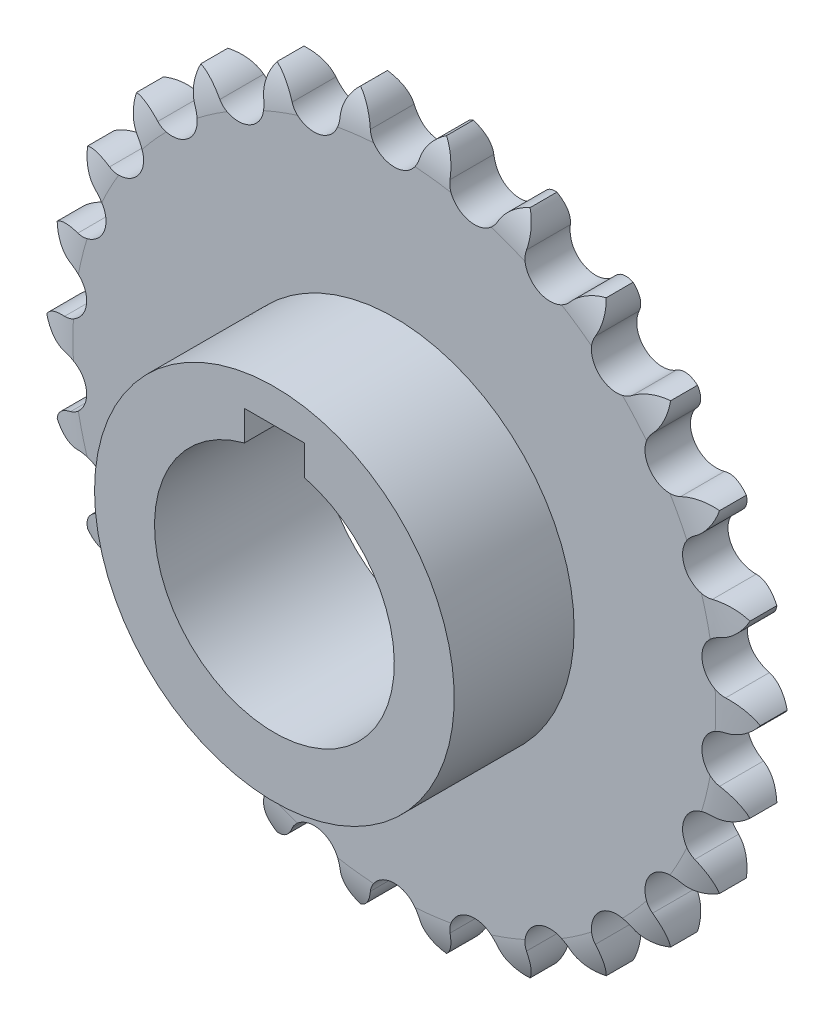
from build123d import *

# Parameters (mm, degrees)
SKETCH2_R           = 12.5
BOSS_EXTRUDE1_DEPTH = 4.7333
SKETCH3_W           = 12.5
SKETCH3_H           = 6.25
SKETCH4_W           = 6.25
SKETCH4_H           = 3.125
CUT_EXTRUDE1_DEPTH  = 56.167615304


with BuildPart() as part:
    # Sketch2 → Boss-Extrude1 (new body)
    with BuildSketch(Plane.XY):
        with BuildLine():
            ThreePointArc((2.578555732, 34.392596644), (0, 32.32485), (-2.578555732, 34.392596644))
            ThreePointArc((-2.578555732, 34.392596644), (-3.257015254, 35.863208352), (-4.483070983, 36.921411294))
            ThreePointArc((-4.483070983, 36.921411294), (-5.42025522, 35.600543465), (-5.727059524, 34.01029907))
            ThreePointArc((-5.727059524, 34.01029907), (-7.735842951, 31.385548607), (-10.734314701, 32.776121514))
            ThreePointArc((-10.734314701, 32.776121514), (-11.74499984, 34.041633927), (-13.188673158, 34.775673074))
            ThreePointArc((-13.188673158, 34.775673074), (-13.782520162, 33.268904395), (-13.699838897, 31.651446536))
            ThreePointArc((-13.699838897, 31.651446536), (-15.022106828, 28.622233211), (-18.266234317, 29.254817338))
            ThreePointArc((-18.266234317, 29.254817338), (-19.550407727, 30.241683474), (-21.127797588, 30.608899139))
            ThreePointArc((-21.127797588, 30.608899139), (-21.343795131, 29.003797528), (-20.876433431, 27.453126977))
            ThreePointArc((-20.876433431, 27.453126977), (-21.435340459, 24.195497658), (-24.73658679, 24.033329515))
            ThreePointArc((-24.73658679, 24.033329515), (-26.21961698, 24.684196302), (-27.839051219, 24.663247244))
            ThreePointArc((-27.839051219, 24.663247244), (-27.664646307, 23.053095374), (-26.839765536, 21.659331467))
            ThreePointArc((-26.839765536, 21.659331467), (-26.602830017, 18.362607728), (-29.769338753, 17.415111938))
            ThreePointArc((-29.769338753, 17.415111938), (-31.365037398, 17.692153364), (-32.932400384, 17.284257068))
            ThreePointArc((-32.932400384, 17.284257068), (-32.377728797, 15.762631112), (-31.243268027, 14.60677434))
            ThreePointArc((-31.243268027, 14.60677434), (-30.224259792, 11.462549783), (-33.072004955, 9.784791356))
            ThreePointArc((-33.072004955, 9.784791356), (-34.68763585, 9.671906781), (-36.111838143, 8.900768696))
            ThreePointArc((-36.111838143, 8.900768696), (-35.209135378, 7.556100024), (-33.831025344, 6.705324582))
            ThreePointArc((-33.831025344, 6.705324582), (-32.089165449, 3.896330109), (-34.45264644, 1.585814268))
            ThreePointArc((-34.45264644, 1.585814268), (-35.994314991, 1.089564132), (-37.19258713, 0))
            ThreePointArc((-37.19258713, 0), (-35.994314991, -1.089564132), (-34.45264644, -1.585814268))
            ThreePointArc((-34.45264644, -1.585814268), (-32.089165449, -3.896330109), (-33.831025344, -6.705324582))
            ThreePointArc((-33.831025344, -6.705324582), (-35.209135378, -7.556100024), (-36.111838143, -8.900768696))
            ThreePointArc((-36.111838143, -8.900768696), (-34.68763585, -9.671906781), (-33.072004955, -9.784791356))
            ThreePointArc((-33.072004955, -9.784791356), (-30.224259792, -11.462549783), (-31.243268027, -14.60677434))
            ThreePointArc((-31.243268027, -14.60677434), (-32.377728797, -15.762631112), (-32.932400384, -17.284257068))
            ThreePointArc((-32.932400384, -17.284257068), (-31.365037398, -17.692153364), (-29.769338753, -17.415111938))
            ThreePointArc((-29.769338753, -17.415111938), (-26.602830017, -18.362607728), (-26.839765536, -21.659331467))
            ThreePointArc((-26.839765536, -21.659331467), (-27.664646307, -23.053095374), (-27.839051219, -24.663247244))
            ThreePointArc((-27.839051219, -24.663247244), (-26.21961698, -24.684196302), (-24.73658679, -24.033329515))
            ThreePointArc((-24.73658679, -24.033329515), (-21.435340459, -24.195497658), (-20.876433431, -27.453126977))
            ThreePointArc((-20.876433431, -27.453126977), (-21.34379513, -29.003797528), (-21.127797588, -30.608899139))
            ThreePointArc((-21.127797588, -30.608899139), (-19.550407727, -30.241683474), (-18.266234317, -29.254817338))
            ThreePointArc((-18.266234317, -29.254817338), (-15.022106828, -28.622233211), (-13.699838897, -31.651446536))
            ThreePointArc((-13.699838897, -31.651446536), (-13.782520162, -33.268904395), (-13.188673158, -34.775673074))
            ThreePointArc((-13.188673158, -34.775673074), (-11.74499984, -34.041633927), (-10.734314701, -32.776121514))
            ThreePointArc((-10.734314701, -32.776121514), (-7.735842951, -31.385548607), (-5.727059524, -34.01029907))
            ThreePointArc((-5.727059524, -34.01029907), (-5.42025522, -35.600543465), (-4.483070983, -36.921411294))
            ThreePointArc((-4.483070983, -36.921411294), (-3.257015254, -35.863208352), (-2.578555732, -34.392596644))
            ThreePointArc((-2.578555732, -34.392596644), (0, -32.32485), (2.578555732, -34.392596644))
            ThreePointArc((2.578555732, -34.392596644), (3.257015254, -35.863208352), (4.483070983, -36.921411294))
            ThreePointArc((4.483070983, -36.921411294), (5.42025522, -35.600543465), (5.727059524, -34.01029907))
            ThreePointArc((5.727059524, -34.01029907), (7.735842951, -31.385548607), (10.734314701, -32.776121514))
            ThreePointArc((10.734314701, -32.776121514), (11.74499984, -34.041633927), (13.188673158, -34.775673074))
            ThreePointArc((13.188673158, -34.775673074), (13.782520162, -33.268904395), (13.699838897, -31.651446536))
            ThreePointArc((13.699838897, -31.651446536), (15.022106828, -28.622233211), (18.266234317, -29.254817338))
            ThreePointArc((18.266234317, -29.254817338), (19.550407727, -30.241683474), (21.127797588, -30.608899139))
            ThreePointArc((21.127797588, -30.608899139), (21.343795131, -29.003797528), (20.876433431, -27.453126977))
            ThreePointArc((20.876433431, -27.453126977), (21.435340459, -24.195497658), (24.736586791, -24.033329515))
            ThreePointArc((24.736586791, -24.033329515), (26.21961698, -24.684196302), (27.839051219, -24.663247244))
            ThreePointArc((27.839051219, -24.663247244), (27.664646307, -23.053095374), (26.839765536, -21.659331467))
            ThreePointArc((26.839765536, -21.659331467), (26.602830017, -18.362607728), (29.769338753, -17.415111938))
            ThreePointArc((29.769338753, -17.415111938), (31.365037398, -17.692153364), (32.932400384, -17.284257068))
            ThreePointArc((32.932400384, -17.284257068), (32.377728797, -15.762631112), (31.243268027, -14.60677434))
            ThreePointArc((31.243268027, -14.60677434), (30.224259792, -11.462549783), (33.072004955, -9.784791356))
            ThreePointArc((33.072004955, -9.784791356), (34.68763585, -9.671906781), (36.111838143, -8.900768696))
            ThreePointArc((36.111838143, -8.900768696), (35.209135378, -7.556100024), (33.831025344, -6.705324582))
            ThreePointArc((33.831025344, -6.705324582), (32.089165449, -3.896330109), (34.45264644, -1.585814268))
            ThreePointArc((34.45264644, -1.585814268), (35.994314991, -1.089564132), (37.19258713, 0))
            ThreePointArc((37.19258713, 0), (35.994314991, 1.089564132), (34.45264644, 1.585814268))
            ThreePointArc((34.45264644, 1.585814268), (32.089165449, 3.896330109), (33.831025344, 6.705324582))
            ThreePointArc((33.831025344, 6.705324582), (35.209135378, 7.556100024), (36.111838143, 8.900768696))
            ThreePointArc((36.111838143, 8.900768696), (34.68763585, 9.671906781), (33.072004955, 9.784791356))
            ThreePointArc((33.072004955, 9.784791356), (30.224259792, 11.462549783), (31.243268027, 14.60677434))
            ThreePointArc((31.243268027, 14.60677434), (32.377728797, 15.762631112), (32.932400384, 17.284257068))
            ThreePointArc((32.932400384, 17.284257068), (31.365037398, 17.692153364), (29.769338753, 17.415111938))
            ThreePointArc((29.769338753, 17.415111938), (26.602830017, 18.362607728), (26.839765536, 21.659331467))
            ThreePointArc((26.839765536, 21.659331467), (27.664646307, 23.053095374), (27.839051219, 24.663247244))
            ThreePointArc((27.839051219, 24.663247244), (26.21961698, 24.684196302), (24.73658679, 24.033329515))
            ThreePointArc((24.73658679, 24.033329515), (21.435340459, 24.195497658), (20.876433431, 27.453126977))
            ThreePointArc((20.876433431, 27.453126977), (21.343795131, 29.003797528), (21.127797588, 30.608899139))
            ThreePointArc((21.127797588, 30.608899139), (19.550407727, 30.241683474), (18.266234317, 29.254817338))
            ThreePointArc((18.266234317, 29.254817338), (15.022106828, 28.622233211), (13.699838897, 31.651446536))
            ThreePointArc((13.699838897, 31.651446536), (13.782520162, 33.268904395), (13.188673158, 34.775673074))
            ThreePointArc((13.188673158, 34.775673074), (11.74499984, 34.041633927), (10.734314701, 32.776121514))
            ThreePointArc((10.734314701, 32.776121514), (7.735842951, 31.385548607), (5.727059524, 34.01029907))
            ThreePointArc((5.727059524, 34.01029907), (5.42025522, 35.600543465), (4.483070983, 36.921411294))
            ThreePointArc((4.483070983, 36.921411294), (3.257015254, 35.863208352), (2.578555732, 34.392596644))
        make_face()
        Circle(SKETCH2_R, mode=Mode.SUBTRACT)
    extrude(amount=BOSS_EXTRUDE1_DEPTH)

    # Sketch3 → Revolve1 (revolve)
    with BuildSketch(Plane(origin=(0, 0, 0), x_dir=(0, 0, -1), z_dir=(1, 0, 0)), mode=Mode.PRIVATE) as revolve1_sk:
        with Locations((-10.9833, 15.625)):
            Rectangle(SKETCH3_W, SKETCH3_H)
    revolve(revolve1_sk.sketch.rotate(Axis((0, 0, 0), (0, 0, 1)), 90), axis=Axis((0, 0, 0), (0, 0, 1)))

    # Sketch4 → Cut-Extrude1 (cut, through all)
    with BuildSketch(Plane.XY.offset(17.2333)):
        with Locations((0, 13.665572957)):
            Rectangle(SKETCH4_W, SKETCH4_H)
    extrude(amount=-CUT_EXTRUDE1_DEPTH, mode=Mode.SUBTRACT)

    # Sketch5 → Cut-Revolve1 (revolve, cut)
    with BuildSketch(Plane(origin=(0, 0, 0), x_dir=(0, 0, -1), z_dir=(1, 0, 0))):
        with BuildLine():
            Line((-4.7333, 33.0833), (-5.485962566, 33.0833))
            Line((-5.485962566, 33.0833), (-5.485962566, 37.3333))
            Line((-5.485962566, 37.3333), (-3.6916333, 37.3333))
            ThreePointArc((-3.6916333, 37.3333), (-4.496405064, 35.277892751), (-4.7333, 33.0833))
        make_face()
        with BuildLine():
            Line((0, 33.0833), (0.752662566, 33.0833))
            Line((0.752662566, 33.0833), (0.752662566, 37.3333))
            Line((0.752662566, 37.3333), (-1.0416667, 37.3333))
            ThreePointArc((-1.0416667, 37.3333), (-0.236894936, 35.277892751), (0, 33.0833))
        make_face()
    revolve(axis=Axis((0, 0, 69.960411833), (0, 0, -1)), mode=Mode.SUBTRACT)


solid = part.part
